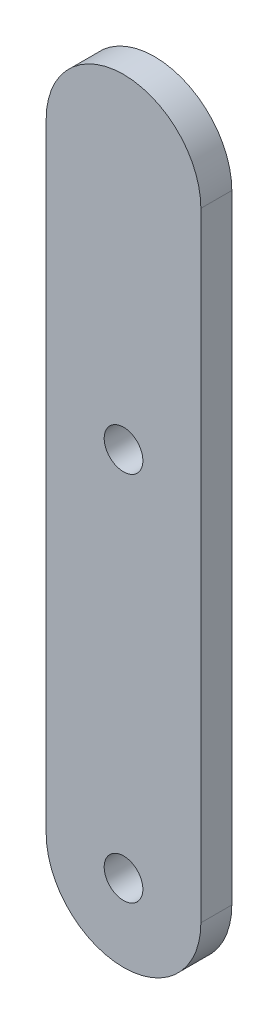
from build123d import *

# Parameters (mm, degrees)
SKETCH1_R           = 1.25
BOSS_EXTRUDE1_DEPTH = 2


with BuildPart() as part:
    # Sketch1 → Boss-Extrude1 (new body)
    with BuildSketch(Plane.XY):
        with BuildLine():
            Line((-5, 0), (-5, 40))
            ThreePointArc((-5, 40), (0, 45), (5, 40))
            Line((5, 40), (5, 0))
            ThreePointArc((5, 0), (0, -5), (-5, 0))
        make_face()
        Circle(SKETCH1_R, mode=Mode.SUBTRACT)
        with Locations((0, 24)):
            Circle(SKETCH1_R, mode=Mode.SUBTRACT)
    extrude(amount=BOSS_EXTRUDE1_DEPTH)


solid = part.part
